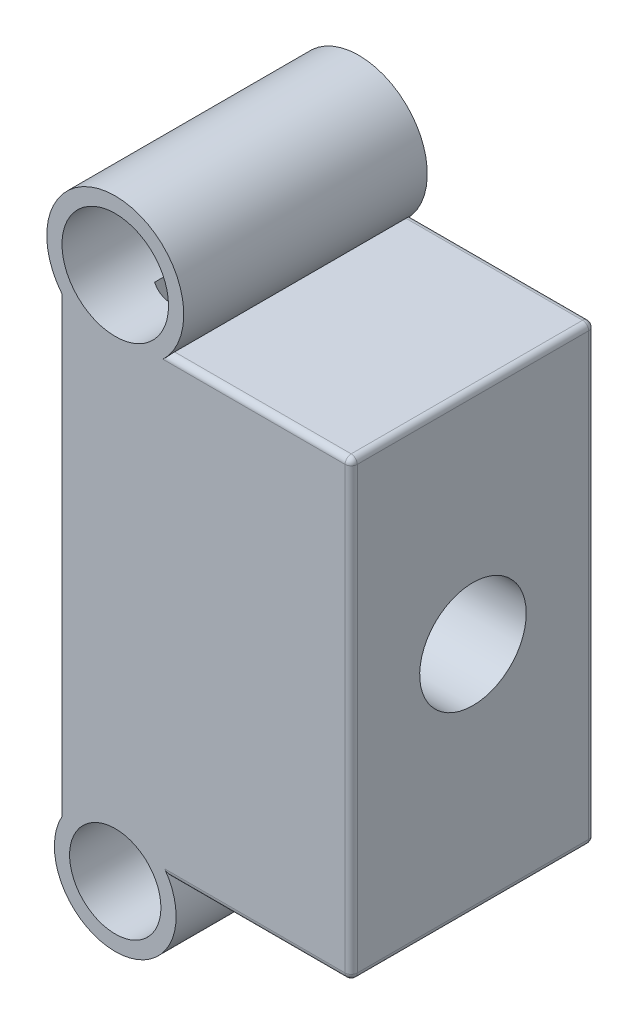
from build123d import *

# Parameters (mm, degrees)
SKETCH1_R            = 17.5
SKETCH1_R_2          = 15
BOSS_EXTRUDE1_DEPTH  = 80
CUT_SWEEP3_PROFILE_R = 2
FILLET2_R            = 2


with BuildPart() as part:
    # Sketch1 → Boss-Extrude1 (new body)
    with BuildSketch(Plane.XY):
        with BuildLine():
            Line((-17.5, 72.107864376), (-17.5, 63.75))
            Line((-17.5, 63.75), (-17.5, -66.25))
            Line((-17.5, -66.25), (-17.5, -76.567541634))
            ThreePointArc((-17.5, -76.567541634), (0, -106.25), (17.5, -76.567541634))
            Line((17.5, -76.567541634), (77.5, -76.567541634))
            Line((77.5, -76.567541634), (77.5, 72.107864376))
            Line((77.5, 72.107864376), (17.5, 72.107864376))
            ThreePointArc((17.5, 72.107864376), (0, 108.75), (-17.5, 72.107864376))
        make_face()
        with Locations((0, 86.25)):
            Circle(SKETCH1_R, mode=Mode.SUBTRACT)
        with Locations((0, -86.25)):
            Circle(SKETCH1_R_2, mode=Mode.SUBTRACT)
    extrude(amount=BOSS_EXTRUDE1_DEPTH)

    # Sketch9 → Cut-Revolve1 (revolve, cut)
    with BuildSketch(Plane.XY.offset(40), mode=Mode.PRIVATE) as cut_revolve1_sk:
        Polygon((-7.353554792, 47.770161371), (-7.353554792, 17.770161371), (6.646445208, 17.770161371), (6.646445208, 45.270161371), (12.283096941, 45.270161371), (12.283096941, 30.270161371), (62.283096941, 30.270161371), (62.283096941, 47.770161371), align=None)
    revolve(cut_revolve1_sk.sketch.rotate(Axis((-48.211470633, 47.770161371, 40), (1, 0, 0)), 270), axis=Axis((-48.211470633, 47.770161371, 40), (1, 0, 0)), mode=Mode.SUBTRACT)

    # Sketch38 → Cut-Revolve3 (revolve, cut)
    with BuildSketch(Plane.XY.offset(40), mode=Mode.PRIVATE) as cut_revolve3_sk:
        Polygon((17, 0), (17, 12.5), (22.475179435, 12.5), (22.475179435, 17.5), (102.052596933, 17.5), (102.052596933, 0), align=None)
    revolve(cut_revolve3_sk.sketch.rotate(Axis((102.052596933, 0, 40), (-1, 0, 0)), 90), axis=Axis((102.052596933, 0, 40), (-1, 0, 0)), mode=Mode.SUBTRACT)

    # Cut-Sweep3: sweep along a path in Sketch60
    with BuildLine(Plane.XY.offset(40)) as cut_sweep3_path:
        Line((57.751179251, 47.84482156), (68.211067836, 47.84482156))
        Line((68.211067836, 47.84482156), (68.211067836, 23.494918311))
        Line((68.211067836, 23.494918311), (19.159559926, 23.494918311))
        Line((19.159559926, 23.494918311), (19.159559926, 12.07117719))
    # Cut-Sweep3 profile (on start of the path) → Cut-Sweep3 (sweep, cut)
    with BuildSketch(Plane(origin=(57.751179251, 47.84482156, 40), x_dir=(0, 0, 1), z_dir=(1, 0, 0))):
        Circle(CUT_SWEEP3_PROFILE_R)
    sweep(path=cut_sweep3_path.line, transition=Transition.RIGHT, mode=Mode.SUBTRACT)

    # Fillet2
    fillet2_edges = [part.edges().sort_by_distance(p)[0] for p in [
        (47.5, -76.567541634, 0),
        (77.5, 72.107864376, 40),
        (77.5, -76.567541634, 40),
        (47.5, -76.567541634, 80),
        (77.5, -2.229838629, 80),
        (47.5, 72.107864376, 80),
        (47.5, 72.107864376, 0),
        (77.5, -2.229838629, 0),
    ]]
    fillet(fillet2_edges, radius=FILLET2_R)


solid = part.part
